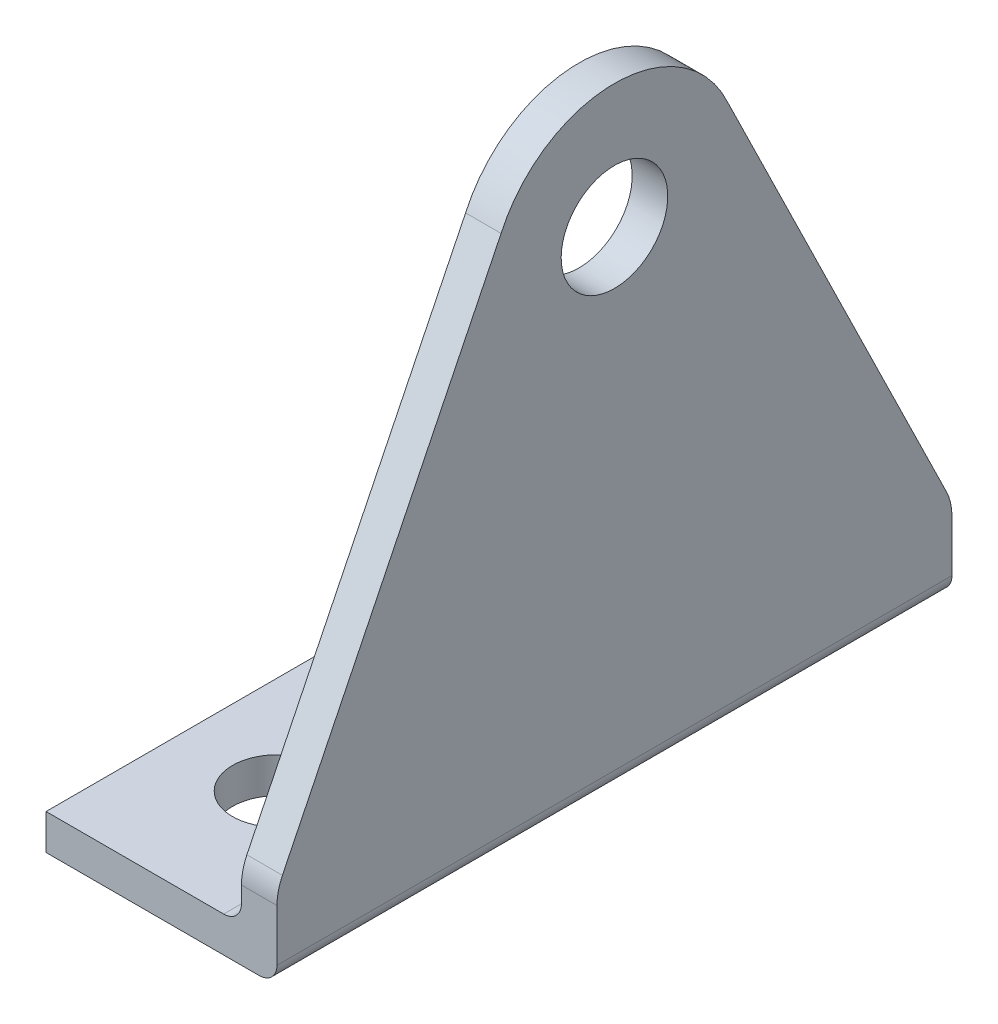
from build123d import *

# Parameters (mm, degrees)
EXTRUDE_1_DEPTH     = 38
SKETCH_2_R          = 2.5
CUT_EXTRUDE_1_DEPTH = 52.664784912
SKETCH_3_R          = 3
CUT_EXTRUDE_2_DEPTH = 53.490475326
CUT_EXTRUDE_3_DEPTH = 53.490475326


with BuildPart() as part:
    # 草图1 → 凸台-拉伸1 (new body)
    with BuildSketch(Plane.XY):
        with BuildLine():
            Line((0, 1), (0, 34.5))
            Line((0, 34.5), (-2, 34.5))
            Line((-2, 34.5), (-2, 3))
            ThreePointArc((-2, 3), (-2.292893219, 2.292893219), (-3, 2))
            Line((-3, 2), (-13, 2))
            Line((-13, 2), (-13, 0))
            Line((-13, 0), (-1, 0))
            ThreePointArc((-1, 0), (-0.292893219, 0.292893219), (0, 1))
        make_face()
    extrude(amount=EXTRUDE_1_DEPTH)

    # 草图2 → 切除-拉伸1 (cut, through all)
    with BuildSketch(Plane(origin=(0, 2, 0), x_dir=(1, 0, 0), z_dir=(0, 1, 0))):
        with Locations(Location((-7.5, -7.5, 0), (0, 0, 270))):
            Circle(SKETCH_2_R)
        with Locations(Location((-7.5, -30.5, 0), (0, 0, 90))):
            Circle(SKETCH_2_R)
    extrude(amount=-CUT_EXTRUDE_1_DEPTH, mode=Mode.SUBTRACT)

    # 草图3 → 切除-拉伸2 (cut, through all)
    with BuildSketch(Plane.ZY.offset(2)):
        with Locations((19, 27.5)):
            Circle(SKETCH_3_R)
    extrude(amount=-CUT_EXTRUDE_2_DEPTH, mode=Mode.SUBTRACT)

    # 草图4 → 切除-拉伸3 (cut, through all)
    with BuildSketch(Plane.ZY.offset(2)):
        with BuildLine():
            Line((0, 34.5), (0, 3.916925189))
            ThreePointArc((0, 3.916925189), (0.077442494, 4.594167854), (0.305771751, 5.23644561))
            Line((0.305771751, 5.23644561), (12.618411108, 30.376686151))
            ThreePointArc((12.618411108, 30.376686151), (15.201105625, 33.379489904), (19, 34.5))
            Line((19, 34.5), (0, 34.5))
        make_face()
        with BuildLine():
            Line((38, 34.5), (19, 34.5))
            ThreePointArc((19, 34.5), (22.798894375, 33.379489904), (25.381588892, 30.376686151))
            Line((25.381588892, 30.376686151), (37.694228249, 5.23644561))
            ThreePointArc((37.694228249, 5.23644561), (37.922557506, 4.594167854), (38, 3.916925189))
            Line((38, 3.916925189), (38, 34.5))
        make_face()
    extrude(amount=-CUT_EXTRUDE_3_DEPTH, mode=Mode.SUBTRACT)


solid = part.part
